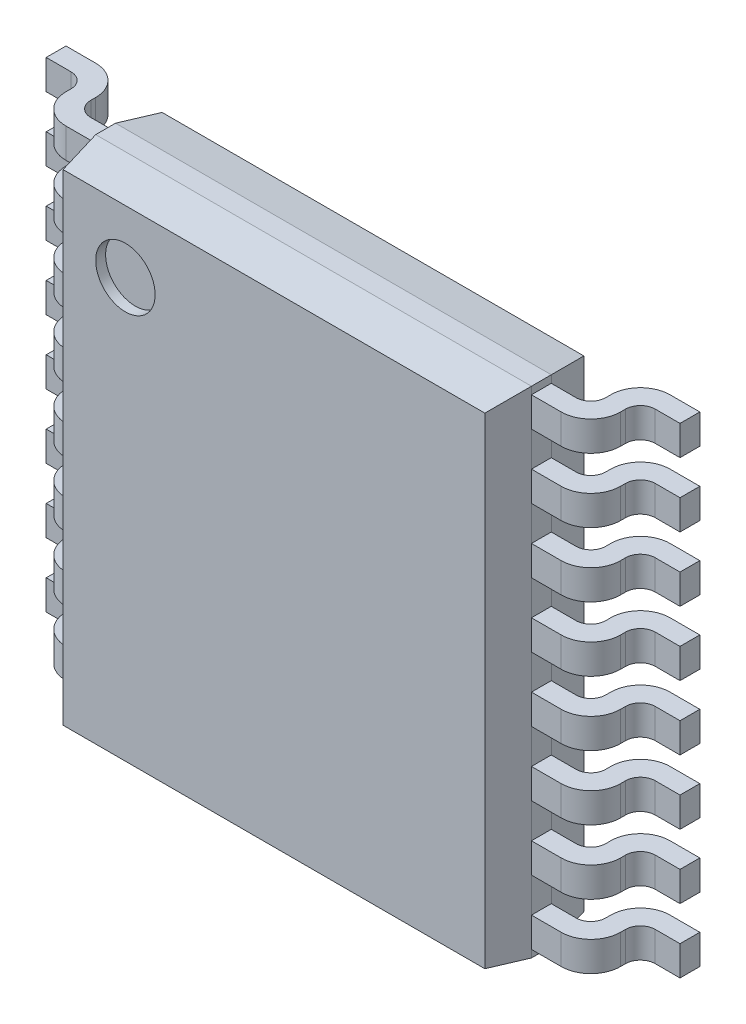
from build123d import *
from OCP.BRepFilletAPI import BRepFilletAPI_MakeChamfer

# Parameters (mm, degrees)
SKETCH_1_W             = 4.4
SKETCH_1_H             = 5
EXTRUDE_1_DEPTH        = 1
CHAMFER_1_SIZE         = 0.4
CHAMFER_1_SIZE2        = 0.070530792
EXTRUDE_2_DEPTH        = 0.15
PATTERN_LINEAR_1_COUNT = 8
PATTERN_LINEAR_1_PITCH = 0.65
SKETCH_4_R             = 0.3
CUT_EXTRUDE_1_DEPTH    = 0.1


with BuildPart() as part:
    # Эскиз1 → Бобышка-Вытянуть1 (new body)
    with BuildSketch(Plane.XY.offset(0.1)):
        Rectangle(SKETCH_1_W, SKETCH_1_H)
    extrude(amount=EXTRUDE_1_DEPTH)

    # Фаска1: one chamfer whose edges measure the first distance from different faces: ONE call of the kernel's chamfer builder (chamfer() names one face for all edges)
    chamfer_1_edges_1 = [part.edges().sort_by_distance(p)[0] for p in [
        (2.2, 0, 1.1),
        (2.2, 0, 0.1),
    ]]
    chamfer_1_side_1 = [part.faces().sort_by_distance(p)[0] for p in [
        (2.2, 0, 0.6),
    ]]
    chamfer_1_edges_2 = [part.edges().sort_by_distance(p)[0] for p in [
        (0, 2.5, 1.1),
        (0, 2.5, 0.1),
    ]]
    chamfer_1_side_2 = [part.faces().sort_by_distance(p)[0] for p in [
        (0, 2.5, 0.6),
    ]]
    chamfer_1_edges_3 = [part.edges().sort_by_distance(p)[0] for p in [
        (-2.2, 0, 1.1),
        (-2.2, 0, 0.1),
    ]]
    chamfer_1_side_3 = [part.faces().sort_by_distance(p)[0] for p in [
        (-2.2, 0, 0.6),
    ]]
    chamfer_1_edges_4 = [part.edges().sort_by_distance(p)[0] for p in [
        (0, -2.5, 0.1),
        (0, -2.5, 1.1),
    ]]
    chamfer_1_side_4 = [part.faces().sort_by_distance(p)[0] for p in [
        (0, -2.5, 0.6),
    ]]
    chamfer_1 = BRepFilletAPI_MakeChamfer(part.part.solid().wrapped)
    for e in chamfer_1_edges_1:
        chamfer_1.Add(CHAMFER_1_SIZE, CHAMFER_1_SIZE2, e.wrapped, chamfer_1_side_1[0].wrapped)  # the first distance lies on this face
    for e in chamfer_1_edges_2:
        chamfer_1.Add(CHAMFER_1_SIZE, CHAMFER_1_SIZE2, e.wrapped, chamfer_1_side_2[0].wrapped)  # the first distance lies on this face
    for e in chamfer_1_edges_3:
        chamfer_1.Add(CHAMFER_1_SIZE, CHAMFER_1_SIZE2, e.wrapped, chamfer_1_side_3[0].wrapped)  # the first distance lies on this face
    for e in chamfer_1_edges_4:
        chamfer_1.Add(CHAMFER_1_SIZE, CHAMFER_1_SIZE2, e.wrapped, chamfer_1_side_4[0].wrapped)  # the first distance lies on this face
    add(Compound.cast(chamfer_1.Shape()), mode=Mode.REPLACE)

    # Эскиз3 → Бобышка-Вытянуть2 (add, symmetric)
    with BuildSketch(Plane(origin=(0, 2.275, 0), x_dir=(-1, 0, 0), z_dir=(0, 1, 0))):
        with BuildLine():
            Line((-2.2, 0.5), (-2.2, 0.7))
            Line((-2.2, 0.7), (-2.5, 0.7))
            ThreePointArc((-2.5, 0.7), (-2.712132034, 0.612132034), (-2.8, 0.4))
            Line((-2.8, 0.4), (-2.8, 0.35))
            ThreePointArc((-2.8, 0.35), (-2.843933983, 0.243933983), (-2.95, 0.2))
            Line((-2.95, 0.2), (-3.2, 0.2))
            Line((-3.2, 0.2), (-3.2, 0))
            Line((-3.2, 0), (-2.9, 0))
            ThreePointArc((-2.9, 0), (-2.687867966, 0.087867966), (-2.6, 0.3))
            Line((-2.6, 0.3), (-2.6, 0.35))
            ThreePointArc((-2.6, 0.35), (-2.556066017, 0.456066017), (-2.45, 0.5))
            Line((-2.45, 0.5), (-2.2, 0.5))
        make_face()
        with BuildLine():
            Line((2.8, 0.4), (2.8, 0.35))
            ThreePointArc((2.8, 0.35), (2.843933983, 0.243933983), (2.95, 0.2))
            Line((2.95, 0.2), (3.2, 0.2))
            Line((3.2, 0.2), (3.2, 0))
            Line((3.2, 0), (2.9, 0))
            ThreePointArc((2.9, 0), (2.687867966, 0.087867966), (2.6, 0.3))
            Line((2.6, 0.3), (2.6, 0.35))
            ThreePointArc((2.6, 0.35), (2.556066017, 0.456066017), (2.45, 0.5))
            Line((2.45, 0.5), (2.2, 0.5))
            Line((2.2, 0.5), (2.2, 0.7))
            Line((2.2, 0.7), (2.5, 0.7))
            ThreePointArc((2.5, 0.7), (2.712132034, 0.612132034), (2.8, 0.4))
        make_face()
    extrude_2 = extrude(amount=EXTRUDE_2_DEPTH, both=True)

    # Линейный массив1: Бобышка-Вытянуть2 ×8
    with Locations(*[(0, -i * PATTERN_LINEAR_1_PITCH, 0) for i in range(1, PATTERN_LINEAR_1_COUNT)]):
        add(extrude_2)

    # Эскиз4 → Вырез-Вытянуть1 (cut)
    with BuildSketch(Plane.XY.offset(1.1)):
        with Locations((-1.5, 1.8)):
            Circle(SKETCH_4_R)
    extrude(amount=-CUT_EXTRUDE_1_DEPTH, mode=Mode.SUBTRACT)


solid = part.part
